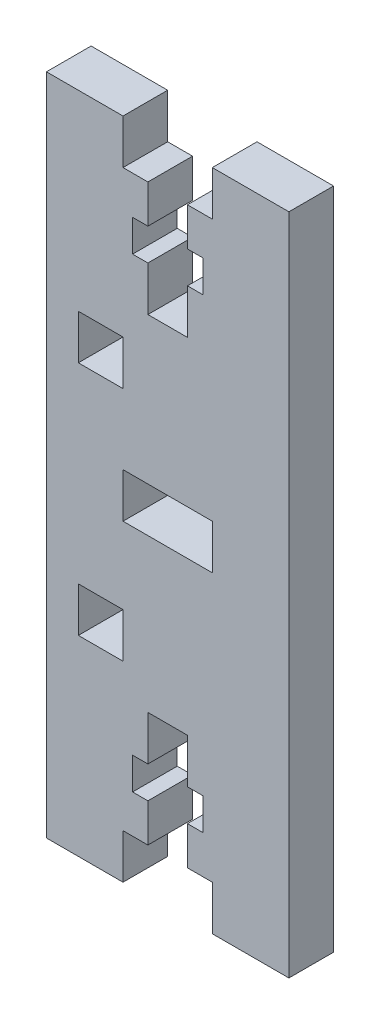
from build123d import *

# Parameters (mm, degrees)
BOSS_EXTRUDE1_DEPTH = 3.5
SKETCH2_W           = 3.5
SKETCH2_H           = 3.5
CUT_EXTRUDE1_DEPTH  = 28.901612857
SKETCH3_W           = 7
SKETCH3_H           = 3.5
CUT_EXTRUDE2_DEPTH  = 28.901612857


with BuildPart() as part:
    # Sketch1 → Boss-Extrude1 (new body)
    with BuildSketch(Plane.XY):
        Polygon((3.5, 26), (3.5, 22.5), (1.55, 22.5), (1.55, 19.5), (2.75, 19.5), (2.75, 17), (1.55, 17), (1.55, 13.5), (-1.55, 13.5), (-1.55, 17), (-2.75, 17), (-2.75, 19.5), (-1.55, 19.5), (-1.55, 22.5), (-3.5, 22.5), (-3.5, 26), (-9.5, 26), (-9.5, -26), (-3.5, -26), (-3.5, -22.5), (-1.55, -22.5), (-1.55, -19.5), (-2.75, -19.5), (-2.75, -17), (-1.55, -17), (-1.55, -13.5), (1.55, -13.5), (1.55, -17), (2.75, -17), (2.75, -19.5), (1.55, -19.5), (1.55, -22.5), (3.5, -22.5), (3.5, -26), (9.5, -26), (9.5, 26), align=None)
    extrude(amount=BOSS_EXTRUDE1_DEPTH)

    # Sketch2 → Cut-Extrude1 (cut, through all)
    with BuildSketch(Plane(origin=(0, 0, 0), x_dir=(-1, 0, 0), z_dir=(0, 0, -1))):
        with Locations((5.25, -9.25)):
            Rectangle(SKETCH2_W, SKETCH2_H)
        with Locations((5.25, 9.25)):
            Rectangle(SKETCH2_W, SKETCH2_H)
    extrude(amount=-CUT_EXTRUDE1_DEPTH, mode=Mode.SUBTRACT)

    # Sketch3 → Cut-Extrude2 (cut, through all)
    with BuildSketch(Plane(origin=(0, 0, 0), x_dir=(-1, 0, 0), z_dir=(0, 0, -1))):
        with Locations((0, 0.25)):
            Rectangle(SKETCH3_W, SKETCH3_H)
    extrude(amount=-CUT_EXTRUDE2_DEPTH, mode=Mode.SUBTRACT)


solid = part.part
